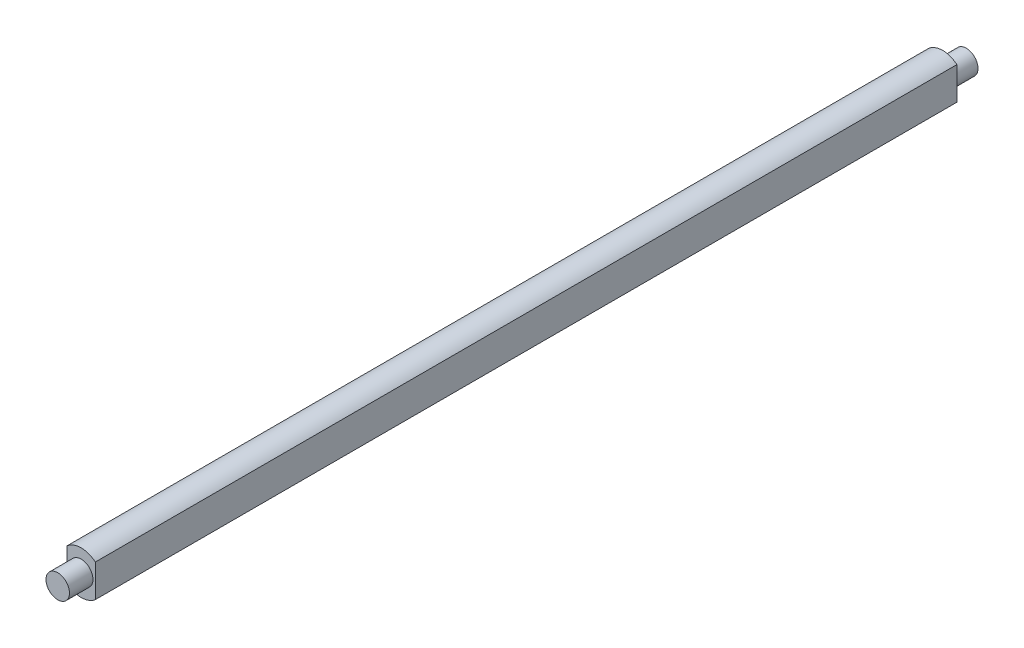
from build123d import *

# Parameters (mm, degrees)
Y_KSEKLIK_EKSTR_ZYON1_DEPTH = 110
IZIM5_R                     = 1.5
Y_KSEKLIK_EKSTR_ZYON3_DEPTH = 3
Y_KSEKLIK_EKSTR_ZYON4_START = 3
IZIM6_R                     = 1.5
Y_KSEKLIK_EKSTR_ZYON4_DEPTH = 3


with BuildPart() as part:
    # Çizim2 → Yükseklik-Ekstrüzyon1 (new body)
    with BuildSketch(Plane.XY):
        with BuildLine():
            ThreePointArc((1.79891634, 2.08), (0, 2.75), (-1.79891634, 2.08))
            Line((-1.79891634, 2.08), (-1.79891634, -2.08))
            ThreePointArc((-1.79891634, -2.08), (0, -2.75), (1.79891634, -2.08))
            Line((1.79891634, -2.08), (1.79891634, 2.08))
        make_face()
    extrude(amount=Y_KSEKLIK_EKSTR_ZYON1_DEPTH)

    # Çizim5 → Yükseklik-Ekstrüzyon3 (add)
    with BuildSketch(Plane.XY.offset(110)):
        Circle(IZIM5_R)
    extrude(amount=Y_KSEKLIK_EKSTR_ZYON3_DEPTH)

    # Çizim6 → Yükseklik-Ekstrüzyon4 (add)
    with BuildSketch(Plane(origin=(0, 0, 0), x_dir=(-1, 0, 0), z_dir=(0, 0, -1)).offset(Y_KSEKLIK_EKSTR_ZYON4_START)):
        with Locations(Location((0, 0, 0), (0, 0, 180))):
            Circle(IZIM6_R)
    extrude(amount=-Y_KSEKLIK_EKSTR_ZYON4_DEPTH)


solid = part.part
